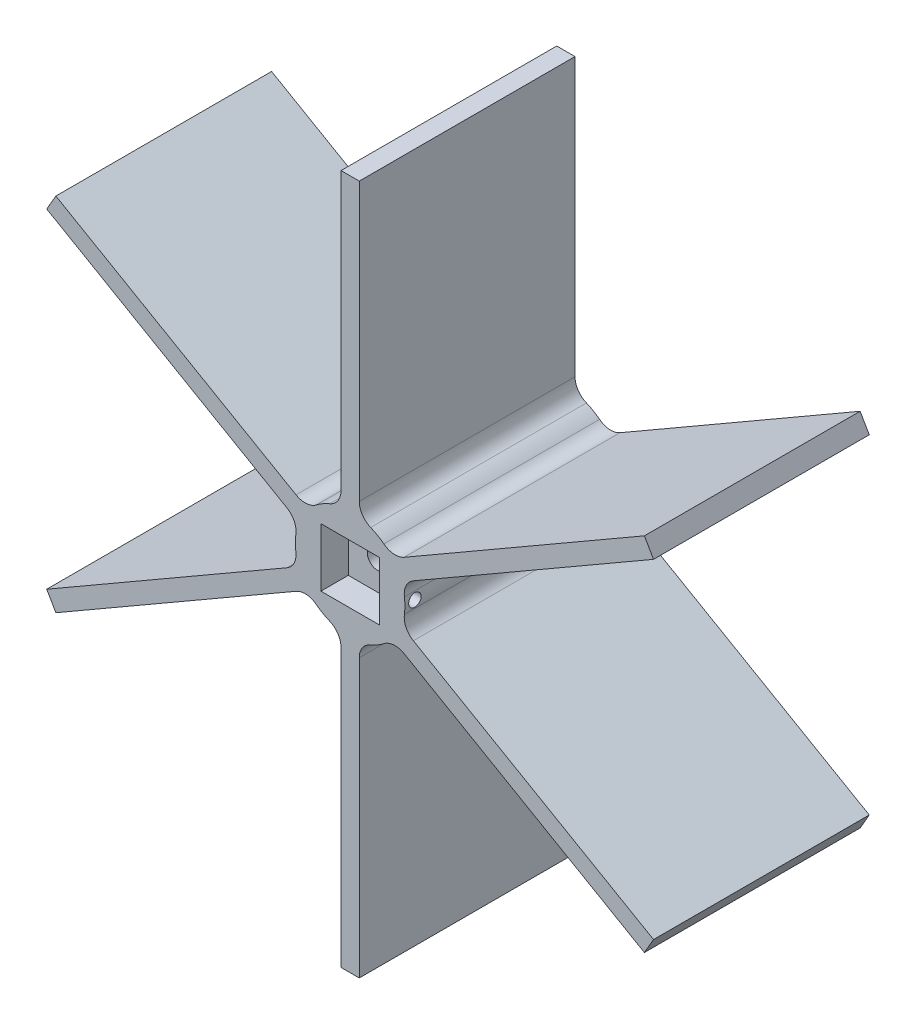
from build123d import *

# Parameters (mm, degrees)
BOSS_EXTRUDE1_DEPTH = 37.5
CIRPATTERN1_COUNT   = 6
FILLET1_R           = 6.35
SKETCH2_W           = 20.32
SKETCH2_H           = 20.32
CUT_EXTRUDE1_DEPTH  = 9.525
SKETCH3_R           = 3.571875
CUT_EXTRUDE2_DEPTH  = 173.631673961
SKETCH4_R           = 2.1828125
CUT_EXTRUDE3_DEPTH  = 171.784747264


with BuildPart() as part:
    # Sketch1 → Boss-Extrude1 (new, symmetric)
    with BuildSketch(Plane.XY):
        with BuildLine():
            Line((-3.175, 119.957990042), (-3.175, 18.783553311))
            ThreePointArc((-3.175, 18.783553311), (0, 19.05), (3.175, 18.783553311))
            Line((3.175, 18.783553311), (3.175, 119.957990042))
            Line((3.175, 119.957990042), (-3.175, 119.957990042))
        make_face()
        with BuildLine():
            Line((-3.175, 18.783553311), (-3.175, 0))
            Line((-3.175, 0), (3.175, 0))
            Line((3.175, 0), (3.175, 18.783553311))
            ThreePointArc((3.175, 18.783553311), (0, 19.05), (-3.175, 18.783553311))
        make_face()
        with BuildLine():
            Line((3.175, 0), (-3.175, 0))
            Line((-3.175, 0), (-3.175, 18.783553311))
            ThreePointArc((-3.175, 18.783553311), (-12.296722124, -14.549677831), (19.05, 0))
            ThreePointArc((19.05, 0), (14.549677831, 12.296722124), (3.175, 18.783553311))
            Line((3.175, 18.783553311), (3.175, 0))
        make_face()
    boss_extrude1 = extrude(amount=BOSS_EXTRUDE1_DEPTH, both=True)

    # CirPattern1: Boss-Extrude1 ×6 about axis
    cirpattern1_axis = Axis((0, 0, 0), (0, 0, 1))
    for i in range(1, CIRPATTERN1_COUNT):
        add(boss_extrude1.rotate(cirpattern1_axis, i * 360 / CIRPATTERN1_COUNT))

    # Fillet1
    fillet1_edges = [part.edges().sort_by_distance(p)[0] for p in [
        (14.679534341, 12.141407313, 0),
        (-17.854534341, 6.642145999, 0),
        (3.175, -18.783553311, 0),
        (17.854534341, -6.642145999, 0),
        (-14.679534341, -12.141407313, 0),
        (-14.679534341, 12.141407313, 0),
        (-3.175, -18.783553311, 0),
        (17.854534341, 6.642145999, 0),
        (14.679534341, -12.141407313, 0),
        (-17.854534341, -6.642145999, 0),
        (-3.175, 18.783553311, 0),
        (3.175, 18.783553311, 0),
    ]]
    fillet(fillet1_edges, radius=FILLET1_R)

    # Sketch2 → Cut-Extrude1 (cut)
    with BuildSketch(Plane.XY.offset(37.5)):
        Rectangle(SKETCH2_W, SKETCH2_H)
    extrude(amount=-CUT_EXTRUDE1_DEPTH, mode=Mode.SUBTRACT)

    # Sketch3 → Cut-Extrude2 (cut, through all)
    with BuildSketch(Plane.XY.offset(27.975)):
        Circle(SKETCH3_R)
    extrude(amount=-CUT_EXTRUDE2_DEPTH, mode=Mode.SUBTRACT)

    # Sketch4 → Cut-Extrude3 (cut, through all)
    with BuildSketch(Plane.ZY.offset(-10.16)):
        with Locations(Location((34.0075, 0, 0), (0, 0, 270))):
            Circle(SKETCH4_R)
    extrude(amount=-CUT_EXTRUDE3_DEPTH, mode=Mode.SUBTRACT)


solid = part.part
